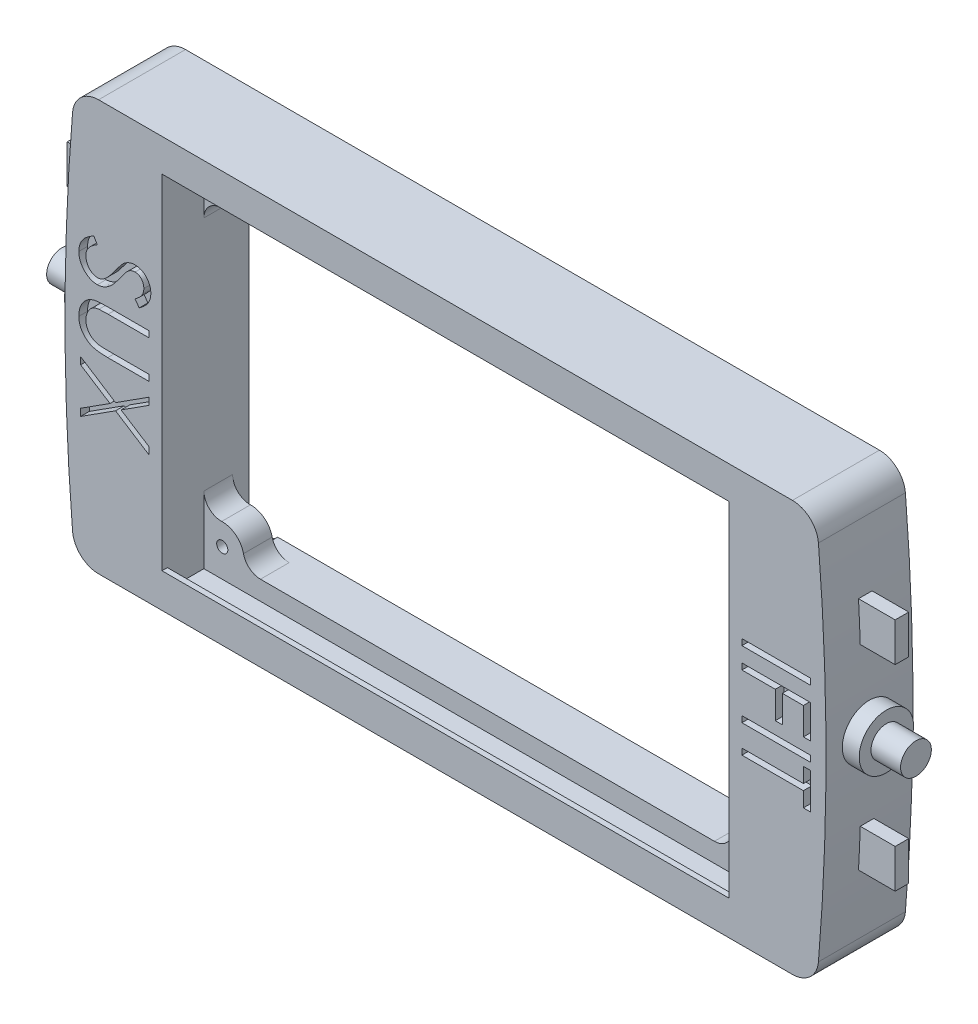
from build123d import *

# Parameters (mm, degrees)
BOSS_EXTRUDE1_DEPTH = 25.4
SKETCH2_R           = 7.9375
BOSS_EXTRUDE2_DEPTH = 116.0526
SKETCH3_R           = 4.4958
BOSS_EXTRUDE3_DEPTH = 124.6886
SKETCH4_W           = 3.9624
SKETCH4_H           = 11.3284
BOSS_EXTRUDE4_DEPTH = 120.904
SKETCH9_W           = 165.608
SKETCH9_H           = 100.336
CUT_EXTRUDE2_DEPTH  = 270.822437479
BOSS_EXTRUDE6_START = -12.25
BOSS_EXTRUDE6_DEPTH = 8.3875
FILLET2_R           = 5.08
SKETCH12_W          = 165.608
SKETCH12_H          = 5.601
CUT_EXTRUDE3_DEPTH  = 10.6625
SKETCH13_R          = 1.625
CUT_EXTRUDE4_DEPTH  = 269.945924424
SKETCH17_W          = 20
SKETCH17_H          = 1.794871794
SKETCH17_H_2        = 1.794871795
CUT_EXTRUDE5_DEPTH  = 2.54
SKETCH18_R          = 4
CUT_EXTRUDE6_DEPTH  = 4.7625
SKETCH19_W          = 165.608
SKETCH19_H          = 3.175
CUT_EXTRUDE7_DEPTH  = 10.6625


with BuildPart() as part:
    # Sketch1 → Boss-Extrude1 (new body)
    with BuildSketch(Plane.XY):
        with BuildLine():
            Line((13.426257014, 1.879412928), (216.063659091, 1.879412928))
            ThreePointArc((216.063659091, 1.879412928), (221.222203621, 3.891042547), (223.657104853, 8.863817565))
            ThreePointArc((223.657104853, 8.863817565), (225.869958053, 61.830097824), (223.657104853, 114.796378083))
            ThreePointArc((223.657104853, 114.796378083), (221.222203621, 119.769153102), (216.063659091, 121.78078272))
            Line((216.063659091, 121.78078272), (13.426257014, 121.78078272))
            ThreePointArc((13.426257014, 121.78078272), (8.267712484, 119.769153102), (5.832811253, 114.796378083))
            ThreePointArc((5.832811253, 114.796378083), (3.619958053, 61.830097824), (5.832811253, 8.863817565))
            ThreePointArc((5.832811253, 8.863817565), (8.267712484, 3.891042547), (13.426257014, 1.879412928))
        make_face()
    extrude(amount=-BOSS_EXTRUDE1_DEPTH)

    # Sketch2 → Boss-Extrude2 (add, symmetric)
    with BuildSketch(Plane(origin=(114.744958053, 0, 0), x_dir=(0, 0, -1), z_dir=(1, 0, 0))):
        with Locations((12.7, 61.830097824)):
            Circle(SKETCH2_R)
    extrude(amount=BOSS_EXTRUDE2_DEPTH, both=True)

    # Sketch3 → Boss-Extrude3 (add, symmetric)
    with BuildSketch(Plane(origin=(114.744958053, 0, 0), x_dir=(0, 0, -1), z_dir=(1, 0, 0))):
        with Locations((12.7, 61.830097824)):
            Circle(SKETCH3_R)
    extrude(amount=BOSS_EXTRUDE3_DEPTH, both=True)

    # Sketch4 → Boss-Extrude4 (add, symmetric)
    with BuildSketch(Plane(origin=(114.744958053, 0, 0), x_dir=(0, 0, -1), z_dir=(1, 0, 0))):
        with Locations((12.3952, 90.481297824)):
            Rectangle(SKETCH4_W, SKETCH4_H)
        with Locations((12.3952, 33.178897824)):
            Rectangle(SKETCH4_W, SKETCH4_H)
    extrude(amount=BOSS_EXTRUDE4_DEPTH, both=True)

    # Sketch9 → Cut-Extrude2 (cut, through all)
    with BuildSketch(Plane.XY):
        with Locations((114.744958053, 62.084097824)):
            Rectangle(SKETCH9_W, SKETCH9_H)
    extrude(amount=-CUT_EXTRUDE2_DEPTH, mode=Mode.SUBTRACT)

    # Sketch10 → Boss-Extrude6 (add)
    with BuildSketch(Plane.XY.offset(BOSS_EXTRUDE6_START)):
        with BuildLine():
            Line((31.940958053, 17.936506343), (31.940958053, 11.916097824))
            Line((31.940958053, 11.916097824), (43.086969717, 11.916097824))
            ThreePointArc((43.086969717, 11.916097824), (40.317759932, 20.117169671), (31.940958053, 17.936506343))
        make_face()
        with BuildLine():
            Line((39.880519232, 112.252097824), (31.940958053, 112.252097824))
            Line((31.940958053, 112.252097824), (31.940958053, 103.043689305))
            ThreePointArc((31.940958053, 103.043689305), (42.109181216, 102.303548347), (39.880519232, 112.252097824))
        make_face()
        with BuildLine():
            Line((197.548958053, 103.043689305), (197.548958053, 112.252097824))
            Line((197.548958053, 112.252097824), (189.609396874, 112.252097824))
            ThreePointArc((189.609396874, 112.252097824), (187.38073489, 102.303548347), (197.548958053, 103.043689305))
        make_face()
        with BuildLine():
            Line((186.402946389, 11.916097824), (197.548958053, 11.916097824))
            Line((197.548958053, 11.916097824), (197.548958053, 17.936506343))
            ThreePointArc((197.548958053, 17.936506343), (189.172156174, 20.117169671), (186.402946389, 11.916097824))
        make_face()
    extrude(amount=-BOSS_EXTRUDE6_DEPTH)

    # Fillet2
    fillet2_edges = [part.edges().sort_by_distance(p)[0] for p in [
        (39.880519232, 112.252097824, -16.44375),
        (31.940958053, 103.043689305, -16.44375),
        (31.940958053, 17.936506343, -16.44375),
        (43.086969717, 11.916097824, -16.44375),
        (186.402946389, 11.916097824, -16.44375),
        (197.548958053, 17.936506343, -16.44375),
        (189.609396874, 112.252097824, -16.44375),
        (197.548958053, 103.043689305, -16.44375),
    ]]
    fillet(fillet2_edges, radius=FILLET2_R)

    # Sketch12 → Cut-Extrude3 (cut)
    with BuildSketch(Plane.XY.offset(-12.25)):
        with Locations((114.744958053, 9.115597824)):
            Rectangle(SKETCH12_W, SKETCH12_H)
    extrude(amount=CUT_EXTRUDE3_DEPTH, mode=Mode.SUBTRACT)

    # Sketch13 → Cut-Extrude4 (cut, through all)
    with BuildSketch(Plane.XY.offset(-12.25)):
        with Locations((37.299958053, 106.450097824)):
            Circle(SKETCH13_R)
        with Locations((192.189958053, 106.450097824)):
            Circle(SKETCH13_R)
        with Locations((192.189958053, 14.530097824)):
            Circle(SKETCH13_R)
        with Locations((37.299958053, 14.530097824)):
            Circle(SKETCH13_R)
    extrude(amount=-CUT_EXTRUDE4_DEPTH, mode=Mode.SUBTRACT)

    # Sketch17 → Cut-Extrude5 (cut)
    with BuildSketch(Plane.XY):
        with Locations((211.308109183, 78.554389565)):
            Rectangle(SKETCH17_W, SKETCH17_H)
        Polygon((221.308109183, 73.297979309), (221.308109183, 63.554389565), (219.256827131, 63.554389565), (219.256827131, 71.503107514), (213.102980978, 71.503107514), (213.102980978, 63.554389565), (211.051698926, 63.554389565), (211.051698926, 71.503107514), (201.308109183, 71.503107514), (201.308109183, 73.297979309), align=None)
        with Locations((211.308109183, 59.067210078)):
            Rectangle(SKETCH17_W, SKETCH17_H_2)
        Polygon((219.256827131, 56.118492129), (221.308109183, 56.118492129), (221.308109183, 45.605671616), (219.256827131, 45.605671616), (219.256827131, 49.964645975), (201.308109183, 49.964645975), (201.308109183, 51.75951777), (219.256827131, 51.75951777), align=None)
        with BuildLine():
            Line((12.042295103, 86.631312642), (13.055916898, 84.940607514))
            add(Edge.make_bspline(
                [(13.055916898, 84.940607514), (12.792691841, 84.783360444), (12.28836279, 84.482081126), (11.606888273, 83.979501931), (11.027675949, 83.458742438), (10.554095334, 82.915946247), (10.181244553, 82.354426543), (9.9172318, 81.770517665), (9.752569084, 81.166187318), (9.732568589, 80.754908338), (9.722583564, 80.549581873)],
                knots=[0, 0, 0, 0, 1.272034388, 2.437168799, 3.508375237, 4.49857839, 5.41946034, 6.295179144, 7.148887113, 8, 8, 8, 8], degree=3))
            add(Edge.make_bspline(
                [(9.722583564, 80.549581873), (9.727467401, 80.374228366), (9.737149619, 80.026589627), (9.830182863, 79.514805646), (9.973108976, 79.017765776), (10.177801279, 78.545720162), (10.425445197, 78.105160266), (10.72458228, 77.718883833), (11.059417863, 77.384737344), (11.43324041, 77.112155943), (11.833885627, 76.900549234), (12.248807687, 76.747424765), (12.676181484, 76.64997025), (12.965928017, 76.637566246), (13.112006641, 76.631312642)],
                knots=[0, 0, 0, 0, 1.095270387, 2.171376115, 3.241375676, 4.322296363, 5.380636668, 6.392615365, 7.366724986, 8.328592944, 9.273498763, 10.190095884, 11.087518669, 12, 12, 12, 12], degree=3))
            add(Edge.make_bspline(
                [(13.112006641, 76.631312642), (13.278525782, 76.639737275), (13.617034863, 76.656863321), (14.116461452, 76.801614636), (14.610704709, 77.029324618), (14.916426227, 77.239396868), (15.075147667, 77.348460078)],
                knots=[0, 0, 0, 0, 0.938893495, 1.908633276, 2.914225137, 4, 4, 4, 4], degree=3))
            add(Edge.make_bspline(
                [(15.075147667, 77.348460078), (15.189935119, 77.437752941), (15.431624388, 77.6257624), (15.785369932, 77.953457758), (16.159174746, 78.327981882), (16.551520894, 78.751207117), (16.95524316, 79.231546302), (17.378757172, 79.759136258), (17.820790113, 80.336708097), (18.113102182, 80.743754629), (18.264250231, 80.954229309)],
                knots=[0, 0, 0, 0, 0.72226686, 1.520759855, 2.393439377, 3.351307446, 4.386958158, 5.510256019, 6.712608938, 8, 8, 8, 8], degree=3))
            add(Edge.make_bspline(
                [(18.264250231, 80.954229309), (18.41416218, 81.164624076), (18.70078241, 81.566882849), (19.125620536, 82.129866186), (19.516518552, 82.632622243), (19.868031393, 83.077712811), (20.195490268, 83.453622835), (20.481345211, 83.774094532), (20.740860551, 84.027304491), (20.909077522, 84.168209861), (20.984602795, 84.231472898)],
                knots=[0, 0, 0, 0, 1.452255772, 2.776602448, 3.96446981, 5.032613149, 5.964194703, 6.766668629, 7.446264616, 8, 8, 8, 8], degree=3))
            add(Edge.make_bspline(
                [(20.984602795, 84.231472898), (21.102323006, 84.319887443), (21.333835599, 84.493766509), (21.695691929, 84.723286541), (22.066110588, 84.918367471), (22.446086957, 85.071295083), (22.830286551, 85.200073477), (23.223722241, 85.286690224), (23.624628632, 85.340926777), (23.894420064, 85.346480986), (24.02947459, 85.34926136)],
                knots=[0, 0, 0, 0, 1.068054152, 2.10047183, 3.106115577, 4.101338837, 5.06977816, 6.043150881, 7.020423561, 8, 8, 8, 8], degree=3))
            add(Edge.make_bspline(
                [(24.02947459, 85.34926136), (24.241091019, 85.341835557), (24.659800724, 85.327142672), (25.271148423, 85.201867693), (25.856603435, 85.006447004), (26.403269972, 84.723811472), (26.909869647, 84.374369302), (27.368662446, 83.961383549), (27.757639187, 83.47105387), (28.09355442, 82.930067679), (28.358773542, 82.341737982), (28.55990266, 81.726343793), (28.672346154, 81.081186587), (28.688663185, 80.643474379), (28.696942539, 80.421376745)],
                knots=[0, 0, 0, 0, 1.005541892, 1.989591032, 2.955705311, 3.932863626, 4.905387107, 5.876519979, 6.856563935, 7.871847665, 8.897921447, 9.918317993, 10.943742853, 12, 12, 12, 12], degree=3))
            add(Edge.make_bspline(
                [(28.696942539, 80.421376745), (28.688965947, 80.18566104), (28.673147413, 79.718208612), (28.530684464, 79.029316915), (28.300561696, 78.364781079), (28.035516085, 77.829862293), (27.771985275, 77.411935857), (27.531854879, 77.093240051), (27.25543077, 76.770281549), (26.941947862, 76.440464577), (26.588538299, 76.109374952), (26.197619947, 75.772098124), (25.771582522, 75.427845147), (25.467442512, 75.206383091), (25.311525872, 75.092851103)],
                knots=[0, 0, 0, 0, 1.286821612, 2.551921131, 3.825787379, 5.12137259, 5.803616487, 6.523126609, 7.299589446, 8.125436757, 9.008162487, 9.944516264, 10.946261234, 12, 12, 12, 12], degree=3))
            Line((25.311525872, 75.092851103), (24.081557923, 76.715447257))
            add(Edge.make_bspline(
                [(24.081557923, 76.715447257), (24.207779015, 76.813424013), (24.450851326, 77.002104337), (24.791258797, 77.288558563), (25.102210267, 77.558550786), (25.37229619, 77.824553237), (25.616310088, 78.072516302), (25.825217373, 78.313186901), (26.001096138, 78.543091678), (26.188697575, 78.832926811), (26.375843889, 79.197987166), (26.530832989, 79.655791467), (26.627324502, 80.132906238), (26.639481306, 80.456975894), (26.645660487, 80.621697257)],
                knots=[0, 0, 0, 0, 1.181667846, 2.275615987, 3.290305621, 4.226321945, 5.078535498, 5.862783384, 6.581873284, 7.217493746, 8.414623899, 9.604724551, 10.782505457, 12, 12, 12, 12], degree=3))
            add(Edge.make_bspline(
                [(26.645660487, 80.621697257), (26.638736488, 80.828305957), (26.625384207, 81.226731371), (26.479555719, 81.792389863), (26.249945089, 82.301498006), (25.928145214, 82.738941235), (25.546882399, 83.103152532), (25.108146084, 83.366612297), (24.623675212, 83.525184665), (24.28572289, 83.544534835), (24.113609205, 83.554389565)],
                knots=[0, 0, 0, 0, 1.14458467, 2.207223713, 3.21896685, 4.227309161, 5.202851033, 6.127160689, 7.046193047, 8, 8, 8, 8], degree=3))
            add(Edge.make_bspline(
                [(24.113609205, 83.554389565), (24.006485218, 83.552038547), (23.792062075, 83.547332668), (23.474435573, 83.486127677), (23.159628532, 83.399340839), (22.846241133, 83.272322957), (22.526900699, 83.101235574), (22.202469409, 82.868608165), (21.864756153, 82.5775817), (21.645326721, 82.354212696), (21.52947459, 82.236280591)],
                knots=[0, 0, 0, 0, 0.858526328, 1.718456515, 2.587092892, 3.476767204, 4.426280253, 5.487868114, 6.673670035, 8, 8, 8, 8], degree=3))
            add(Edge.make_bspline(
                [(21.52947459, 82.236280591), (21.490405871, 82.19250132), (21.397587538, 82.088491793), (21.245631648, 81.898343646), (21.058187235, 81.647241942), (20.826259713, 81.34174365), (20.557222786, 80.976215868), (20.254516431, 80.550618405), (19.908313808, 80.06969536), (19.666270719, 79.728427269), (19.538288693, 79.547979309)],
                knots=[0, 0, 0, 0, 0.420754252, 0.999615792, 1.744751191, 2.668019286, 3.750313428, 4.999500688, 6.413464383, 8, 8, 8, 8], degree=3))
            add(Edge.make_bspline(
                [(19.538288693, 79.547979309), (19.380338067, 79.330916947), (19.074488571, 78.910605768), (18.614970399, 78.312562454), (18.165554579, 77.770312122), (17.72911111, 77.281950959), (17.308950578, 76.842654339), (16.900018119, 76.457295935), (16.505243418, 76.12194919), (15.999114414, 75.760925085), (15.377508218, 75.392023259), (14.615918284, 75.075214645), (13.851367881, 74.87545266), (13.337500244, 74.849329714), (13.08396177, 74.836440847)],
                knots=[0, 0, 0, 0, 1.163667725, 2.253281268, 3.268753668, 4.215851969, 5.092017293, 5.902905408, 6.650798638, 7.335211899, 8.59617414, 9.77448103, 10.901945474, 12, 12, 12, 12], degree=3))
            add(Edge.make_bspline(
                [(13.08396177, 74.836440847), (12.90465824, 74.840198008), (12.549533133, 74.847639369), (12.028054996, 74.93309997), (11.521669331, 75.058468016), (11.036176674, 75.246829708), (10.565080732, 75.478532383), (10.112720964, 75.764718444), (9.685315903, 76.109715555), (9.273971294, 76.493165872), (8.902408852, 76.919306621), (8.570087863, 77.368631261), (8.291937282, 77.844056853), (8.068025347, 78.343282287), (7.890126156, 78.863545948), (7.762255935, 79.405395357), (7.683596712, 79.9703394), (7.675445666, 80.354345537), (7.671301513, 80.549581873)],
                knots=[0, 0, 0, 0, 0.983610584, 1.948120116, 2.894308362, 3.843560551, 4.801159957, 5.773581695, 6.77566113, 7.813174769, 8.857584665, 9.875476876, 10.877851407, 11.875574773, 12.875048225, 13.892438445, 14.928473903, 16, 16, 16, 16], degree=3))
            add(Edge.make_bspline(
                [(7.671301513, 80.549581873), (7.674256021, 80.700634309), (7.680127828, 81.000836831), (7.730808579, 81.443680816), (7.805132518, 81.878392842), (7.918449604, 82.299514576), (8.059171427, 82.712289747), (8.23146494, 83.113039005), (8.436571608, 83.50273599), (8.674831156, 83.88183576), (8.949416891, 84.253910524), (9.266740708, 84.617052762), (9.624610789, 84.975416855), (10.026697177, 85.322433434), (10.468703988, 85.664498922), (10.954334806, 85.995251994), (11.481068693, 86.321427756), (11.851725456, 86.526088347), (12.042295103, 86.631312642)],
                knots=[0, 0, 0, 0, 0.915384692, 1.819241058, 2.699029451, 3.586605375, 4.459625921, 5.340865773, 6.228072412, 7.126546901, 8.052715223, 9.028303326, 10.047266019, 11.120332924, 12.245748783, 13.433636234, 14.680528497, 16, 16, 16, 16], degree=3))
        make_face()
        with BuildLine():
            Line((28.184122026, 70.733876745), (28.184122026, 68.93900495))
            Line((28.184122026, 68.93900495), (16.200948949, 68.93900495))
            add(Edge.make_bspline(
                [(16.200948949, 68.93900495), (16.031344745, 68.939272058), (15.709491539, 68.939778942), (15.251386965, 68.936393149), (14.84411577, 68.926911044), (14.48610807, 68.920932989), (14.179006656, 68.90763394), (13.921147738, 68.896787958), (13.713752295, 68.88284192), (13.592718432, 68.866081248), (13.540692539, 68.858876745)],
                knots=[0, 0, 0, 0, 1.528628734, 2.90083645, 4.128790002, 5.200304208, 6.127813768, 6.898992206, 7.526736466, 8, 8, 8, 8], degree=3))
            add(Edge.make_bspline(
                [(13.540692539, 68.858876745), (13.352980492, 68.829319983), (12.9881333, 68.771871879), (12.468879799, 68.624928271), (11.999302027, 68.421361316), (11.570034835, 68.173507215), (11.187460077, 67.854760935), (10.832275539, 67.475389483), (10.525421233, 67.011467327), (10.24311679, 66.495950448), (10.016542726, 65.939962902), (9.845130395, 65.371917178), (9.740685051, 64.800238269), (9.72858982, 64.417517947), (9.722583564, 64.227466488)],
                knots=[0, 0, 0, 0, 1.035924841, 2.013479024, 2.933602255, 3.82183108, 4.706948133, 5.639927629, 6.646101806, 7.731477349, 8.84205456, 9.913728764, 10.963998332, 12, 12, 12, 12], degree=3))
            add(Edge.make_bspline(
                [(9.722583564, 64.227466488), (9.728719513, 64.064301961), (9.740955969, 63.738915303), (9.816740626, 63.255454393), (9.953296005, 62.784579801), (10.129596366, 62.324068344), (10.3621687, 61.892111889), (10.632688776, 61.489019567), (10.945370758, 61.125411598), (11.296342814, 60.797505221), (11.688729325, 60.510407817), (12.121348037, 60.268171864), (12.592776802, 60.064013384), (12.925201877, 59.963962501), (13.095981, 59.912562642)],
                knots=[0, 0, 0, 0, 0.994510594, 1.983277156, 2.972612928, 3.9776239, 4.982470102, 5.955333794, 6.930747147, 7.898149105, 8.876444039, 9.885893618, 10.913904934, 12, 12, 12, 12], degree=3))
            add(Edge.make_bspline(
                [(13.095981, 59.912562642), (13.166544282, 59.895419069), (13.323787711, 59.857216279), (13.589623657, 59.821518879), (13.903277166, 59.784338734), (14.26700181, 59.758541191), (14.679578797, 59.73339136), (15.143157411, 59.71834523), (15.65605433, 59.711390756), (16.013980968, 59.709318297), (16.200948949, 59.708235719)],
                knots=[0, 0, 0, 0, 0.558680831, 1.244966039, 2.062412453, 2.990489873, 4.051219941, 5.244515665, 6.560634259, 8, 8, 8, 8], degree=3))
            Line((16.200948949, 59.708235719), (28.184122026, 59.708235719))
            Line((28.184122026, 59.708235719), (28.184122026, 57.913363924))
            Line((28.184122026, 57.913363924), (16.104795103, 57.913363924))
            add(Edge.make_bspline(
                [(16.104795103, 57.913363924), (15.887087738, 57.914799998), (15.462218579, 57.917602584), (14.839671924, 57.942400166), (14.248968504, 57.980795719), (13.690862021, 58.038841466), (13.164687852, 58.102921882), (12.671214731, 58.194607988), (12.207133803, 58.29045556), (11.773239637, 58.411691716), (11.363791374, 58.5579425), (10.967989469, 58.729174449), (10.589069461, 58.938701067), (10.221558745, 59.177799586), (9.864953844, 59.443264254), (9.527629287, 59.749244705), (9.198525889, 60.07989936), (8.888503526, 60.442193339), (8.602164995, 60.82965204), (8.355856588, 61.242963719), (8.139583701, 61.673805912), (7.96874902, 62.126793302), (7.836522251, 62.598975378), (7.739212643, 63.090327737), (7.683698523, 63.602521293), (7.675468882, 63.950894938), (7.671301513, 64.127306232)],
                knots=[0, 0, 0, 0, 1.316364231, 2.568964831, 3.766826305, 4.894964518, 5.961692026, 6.970710131, 7.928946231, 8.826316495, 9.692177228, 10.556379512, 11.43093279, 12.306715499, 13.20629939, 14.115652445, 15.057829886, 16.025681089, 16.996391533, 17.967202739, 18.931442607, 19.907779629, 20.889445314, 21.893507297, 22.933303057, 24, 24, 24, 24], degree=3))
            add(Edge.make_bspline(
                [(7.671301513, 64.127306232), (7.675785886, 64.319701104), (7.68458421, 64.697179154), (7.734999925, 65.253396682), (7.829962178, 65.786620661), (7.950876142, 66.302482815), (8.117640355, 66.793959942), (8.312486783, 67.267636767), (8.551785413, 67.715400659), (8.818033373, 68.144515679), (9.117602734, 68.543514286), (9.444118014, 68.909785161), (9.792348742, 69.243932993), (10.166065118, 69.540325543), (10.562360586, 69.803873455), (10.982356242, 70.030903246), (11.425889477, 70.22583607), (11.73419348, 70.326445024), (11.890051513, 70.377306232)],
                knots=[0, 0, 0, 0, 1.13879206, 2.234305948, 3.301075583, 4.341971843, 5.366689343, 6.369221514, 7.369726634, 8.367512178, 9.355451585, 10.318319045, 11.268648973, 12.207971039, 13.137398894, 14.081662264, 15.030215811, 16, 16, 16, 16], degree=3))
            add(Edge.make_bspline(
                [(11.890051513, 70.377306232), (11.996523367, 70.406889993), (12.22746319, 70.471057829), (12.609671696, 70.539773816), (13.049756939, 70.597539996), (13.547749044, 70.651857472), (14.104033996, 70.68390866), (14.718370658, 70.71200831), (15.391501868, 70.734074703), (15.860384814, 70.733944575), (16.104795103, 70.733876745)],
                knots=[0, 0, 0, 0, 0.625038921, 1.35572334, 2.194682327, 3.136881307, 4.189498639, 5.346923369, 6.617055217, 8, 8, 8, 8], degree=3))
            Line((16.104795103, 70.733876745), (28.184122026, 70.733876745))
        make_face()
        Polygon((28.184122026, 53.93900495), (28.184122026, 51.867690847), (20.003032282, 46.631312642), (28.184122026, 41.394934437), (28.184122026, 39.323620334), (18.384442539, 45.593652386), (8.184122026, 39.067210078), (8.184122026, 41.13852418), (16.765852795, 46.631312642), (8.184122026, 52.124101103), (8.184122026, 54.195415206), (18.384442539, 47.664966488), align=None)
    extrude(amount=-CUT_EXTRUDE5_DEPTH, mode=Mode.SUBTRACT)

    # Sketch18 → Cut-Extrude6 (cut)
    with BuildSketch(Plane(origin=(0, 0, -25.4), x_dir=(-1, 0, 0), z_dir=(0, 0, -1))):
        with Locations((-192.189958053, 14.530097824)):
            Circle(SKETCH18_R)
        with Locations((-37.299958053, 14.530097824)):
            Circle(SKETCH18_R)
    extrude(amount=-CUT_EXTRUDE6_DEPTH, mode=Mode.SUBTRACT)

    # Sketch19 → Cut-Extrude7 (cut)
    with BuildSketch(Plane.XY.offset(-12.25)):
        with Locations((114.744958053, 113.839597824)):
            Rectangle(SKETCH19_W, SKETCH19_H)
    extrude(amount=CUT_EXTRUDE7_DEPTH, mode=Mode.SUBTRACT)


solid = part.part
